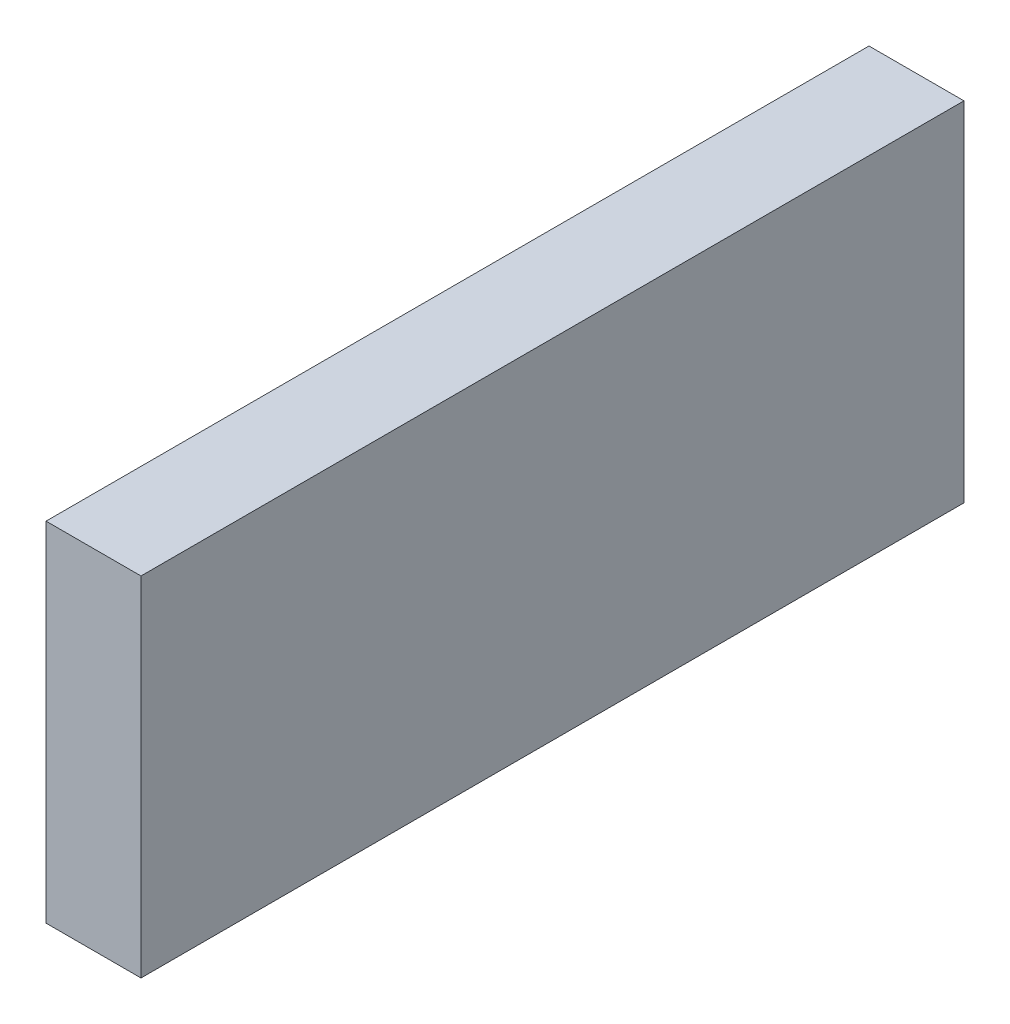
from build123d import *

# Parameters (mm, degrees)
SKETCH2_W           = 30
SKETCH2_H           = 260
BOSS_EXTRUDE1_DEPTH = 110


with BuildPart() as part:
    # Sketch2 → Boss-Extrude1 (new body)
    with BuildSketch(Plane(origin=(0, 0, 0), x_dir=(1, 0, 0), z_dir=(0, 1, 0))):
        Rectangle(SKETCH2_W, SKETCH2_H)
    extrude(amount=BOSS_EXTRUDE1_DEPTH)


solid = part.part
